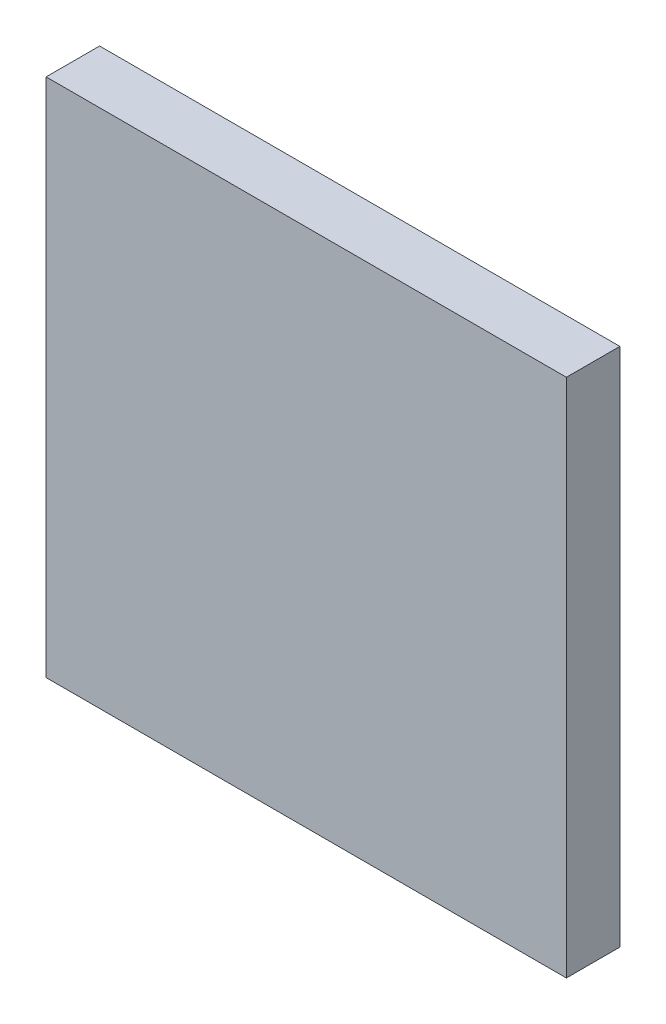
from build123d import *

# Parameters (mm, degrees)
SKETCH1_W               = 9.729
SKETCH1_H               = 9.729
COMPONENT_OUTLINE_DEPTH = 1


with BuildPart() as part:
    # Sketch1 → Component_Outline (new body)
    with BuildSketch(Plane.XY):
        Rectangle(SKETCH1_W, SKETCH1_H)
    extrude(amount=COMPONENT_OUTLINE_DEPTH)


solid = part.part
